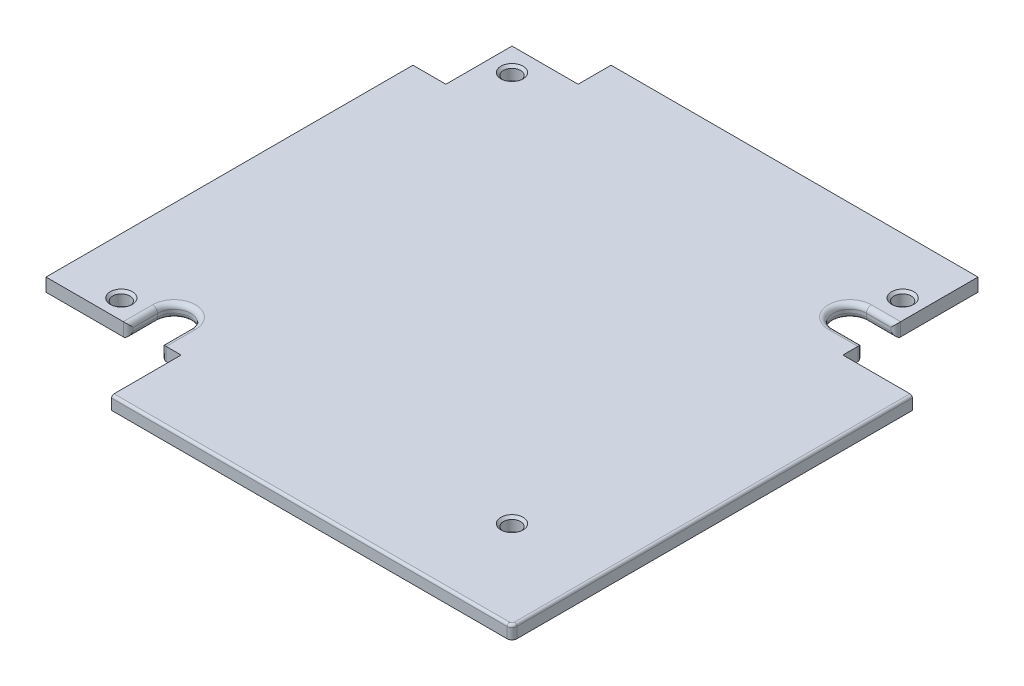
from build123d import *

# Parameters (mm, degrees)
SKETCH1_R           = 1.85
BOSS_EXTRUDE1_DEPTH = 2
CHAMFER2_SIZE       = 1.5
CUT_EXTRUDE2_START  = -2
SKETCH1_4_R         = 2.6
SKETCH1_4_R_2       = 1.85
CUT_EXTRUDE2_DEPTH  = 3.25
FILLET1_R           = 0.75
FILLET2_R           = 1.5


with BuildPart() as part:
    # Sketch1 → Boss-Extrude1 (new, symmetric)
    with BuildSketch(Plane(origin=(0, 0, 0), x_dir=(1, 0, 0), z_dir=(0, 1, 0))):
        with BuildLine():
            Line((-66.2, 46.15), (-76.2, 46.15))
            Line((-76.2, 46.15), (-76.2, -65.15))
            Line((-76.2, -65.15), (-51.25, -65.15))
            Line((-51.25, -65.15), (-51.25, -56.25))
            ThreePointArc((-51.25, -56.25), (-46.25, -51.25), (-41.25, -56.25))
            Line((-41.25, -56.25), (-41.25, -65.15))
            Line((-41.25, -65.15), (-35.22, -65.15))
            Line((-35.22, -65.15), (-35.22, -86.25))
            Line((-35.22, -86.25), (84.75, -86.25))
            ThreePointArc((84.75, -86.25), (85.810660172, -85.810660172), (86.25, -84.75))
            Line((86.25, -84.75), (86.25, 35.22))
            Line((86.25, 35.22), (65.15, 35.22))
            Line((65.15, 35.22), (65.15, 41.25))
            Line((65.15, 41.25), (56.25, 41.25))
            ThreePointArc((56.25, 41.25), (51.25, 46.25), (56.25, 51.25))
            Line((56.25, 51.25), (65.15, 51.25))
            Line((65.15, 51.25), (65.15, 76.2))
            Line((65.15, 76.2), (-46.15, 76.2))
            Line((-46.15, 76.2), (-46.15, 66.2))
            Line((-46.15, 66.2), (-66.2, 66.2))
            Line((-66.2, 66.2), (-66.2, 46.15))
        make_face()
        with Locations(Location((-59.25, 59.25, 0), (0, 0, 270))):
            Circle(SKETCH1_R, mode=Mode.SUBTRACT)
        with Locations(Location((-59.25, -59.25, 0), (0, 0, 270))):
            Circle(SKETCH1_R, mode=Mode.SUBTRACT)
        with Locations(Location((59.25, -59.25, 0), (0, 0, 270))):
            Circle(SKETCH1_R, mode=Mode.SUBTRACT)
        with Locations(Location((59.25, 59.25, 0), (0, 0, 270))):
            Circle(SKETCH1_R, mode=Mode.SUBTRACT)
    extrude(amount=BOSS_EXTRUDE1_DEPTH, both=True)

    # Chamfer2
    chamfer2_edges = [part.edges().sort_by_distance(p)[0] for p in [
        (-59.25, 2, 57.4),
        (59.25, 2, 57.4),
        (59.25, 2, -61.1),
        (-59.25, 2, -61.1),
    ]]
    chamfer(chamfer2_edges, length=CHAMFER2_SIZE)

    # Sketch1<4> → Cut-Extrude2 (cut)
    # profile 1 of 4: a face of its own
    with BuildSketch(Plane(origin=(0, 0, 0), x_dir=(1, 0, 0), z_dir=(0, 1, 0)).offset(CUT_EXTRUDE2_START)):
        with Locations(Location((-59.25, 59.25, 0), (0, 0, 270))):
            Circle(SKETCH1_4_R)
        with Locations((-59.25, 59.25)):
            Circle(SKETCH1_4_R_2, mode=Mode.SUBTRACT)
    # profile 2 of 4: a face of its own
    with BuildSketch(Plane(origin=(0, 0, 0), x_dir=(1, 0, 0), z_dir=(0, 1, 0)).offset(CUT_EXTRUDE2_START)):
        with Locations(Location((-59.25, -59.25, 0), (0, 0, 270))):
            Circle(SKETCH1_4_R)
        with Locations((-59.25, -59.25)):
            Circle(SKETCH1_4_R_2, mode=Mode.SUBTRACT)
    # profile 3 of 4: a face of its own
    with BuildSketch(Plane(origin=(0, 0, 0), x_dir=(1, 0, 0), z_dir=(0, 1, 0)).offset(CUT_EXTRUDE2_START)):
        with Locations(Location((59.25, -59.25, 0), (0, 0, 270))):
            Circle(SKETCH1_4_R)
        with Locations((59.25, -59.25)):
            Circle(SKETCH1_4_R_2, mode=Mode.SUBTRACT)
    # profile 4 of 4: a face of its own
    with BuildSketch(Plane(origin=(0, 0, 0), x_dir=(1, 0, 0), z_dir=(0, 1, 0)).offset(CUT_EXTRUDE2_START)):
        with Locations(Location((59.25, 59.25, 0), (0, 0, 270))):
            Circle(SKETCH1_4_R)
        with Locations((59.25, 59.25)):
            Circle(SKETCH1_4_R_2, mode=Mode.SUBTRACT)
    extrude(amount=CUT_EXTRUDE2_DEPTH, mode=Mode.SUBTRACT)

    # Fillet1
    fillet1_edges = [part.edges().sort_by_distance(p)[0] for p in [
        (24.765, 2, 86.25),
        (85.810660172, 2, 85.810660172),
        (86.25, 2, 24.765),
    ]]
    fillet(fillet1_edges, radius=FILLET1_R)

    # Fillet2
    fillet2_edges = [part.edges().sort_by_distance(p)[0] for p in [
        (51.25, 2, -46.25),
        (60.7, 2, -51.25),
        (-41.25, -2, 60.7),
        (-46.25, -2, 51.25),
        (-51.25, -2, 60.7),
        (60.7, -2, -51.25),
        (51.25, -2, -46.25),
        (60.7, -2, -41.25),
        (65.15, 0, -41.25),
        (-41.25, 0, 65.15),
        (-51.25, 0, 65.15),
        (65.15, 0, -51.25),
        (-51.25, 2, 60.7),
        (-46.25, 2, 51.25),
        (-41.25, 2, 60.7),
        (60.7, 2, -41.25),
    ]]
    fillet(fillet2_edges, radius=FILLET2_R)


solid = part.part
